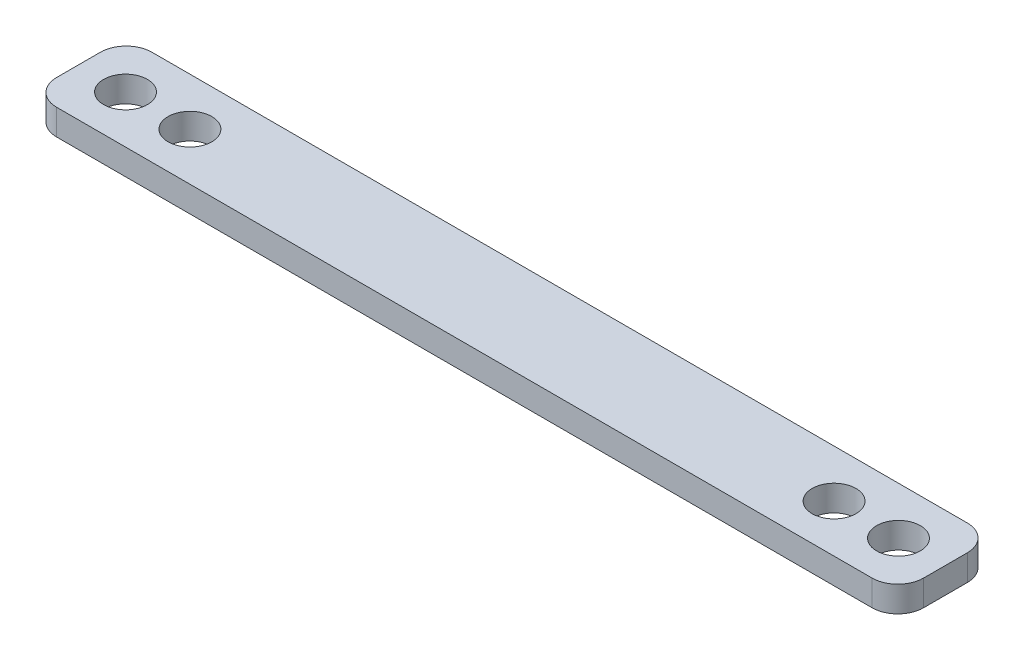
from build123d import *

# Parameters (mm, degrees)
SKETCH_1_R      = 1.7
EXTRUDE_1_DEPTH = 2


with BuildPart() as part:
    # 草图1 → 凸台-拉伸1 (new body)
    with BuildSketch(Plane(origin=(0, 0, 0), x_dir=(1, 0, 0), z_dir=(0, 1, 0))):
        with BuildLine():
            Line((31.843938282, 4.866796825), (-31.456061718, 4.866796825))
            ThreePointArc((-31.456061718, 4.866796825), (-32.87027528, 4.281010387), (-33.456061718, 2.866796825))
            Line((-33.456061718, 2.866796825), (-33.456061718, -0.533203175))
            ThreePointArc((-33.456061718, -0.533203175), (-32.87027528, -1.947416737), (-31.456061718, -2.533203175))
            Line((-31.456061718, -2.533203175), (31.843938282, -2.533203175))
            ThreePointArc((31.843938282, -2.533203175), (33.258151844, -1.947416737), (33.843938282, -0.533203175))
            Line((33.843938282, -0.533203175), (33.843938282, 2.866796825))
            ThreePointArc((33.843938282, 2.866796825), (33.258151844, 4.281010387), (31.843938282, 4.866796825))
        make_face()
        with Locations(Location((-29.806061718, 1.166796825, 0), (0, 0, 270))):
            Circle(SKETCH_1_R, mode=Mode.SUBTRACT)
        with Locations(Location((30.193938282, 1.166796825, 0), (0, 0, 270))):
            Circle(SKETCH_1_R, mode=Mode.SUBTRACT)
        with Locations(Location((-24.806061718, 1.166796825, 0), (0, 0, 270))):
            Circle(SKETCH_1_R, mode=Mode.SUBTRACT)
        with Locations(Location((25.193938282, 1.166796825, 0), (0, 0, 270))):
            Circle(SKETCH_1_R, mode=Mode.SUBTRACT)
    extrude(amount=EXTRUDE_1_DEPTH)


solid = part.part
